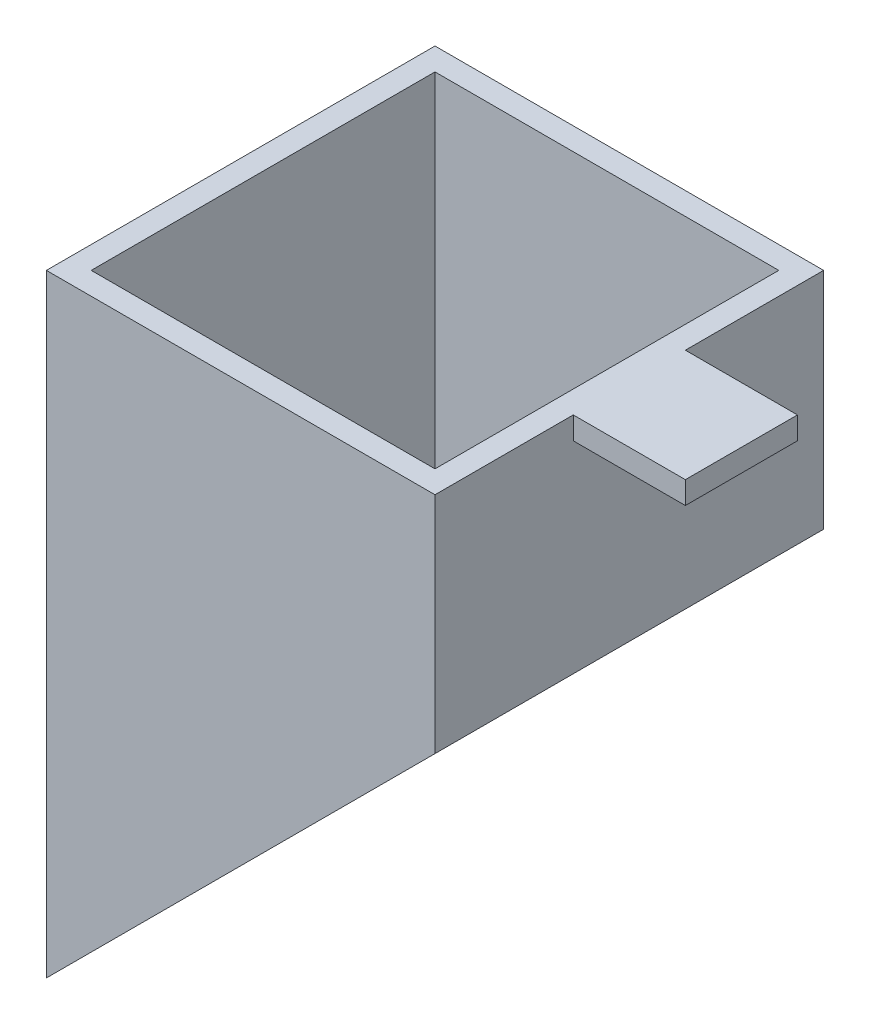
from build123d import *

# Parameters (mm, degrees)
CROQUIS1_W              = 52
CROQUIS1_H              = 52
SALIENTE_EXTRUIR1_DEPTH = 30
SALIENTE_EXTRUIR2_DEPTH = 52
VACIADO4_T              = -3
SALIENTE_EXTRUIR3_DEPTH = 3


with BuildPart() as part:
    # Croquis1 → Saliente-Extruir1 (new body)
    with BuildSketch(Plane(origin=(0, 0, 0), x_dir=(1, 0, 0), z_dir=(0, 1, 0))):
        with Locations((26, 26)):
            Rectangle(CROQUIS1_W, CROQUIS1_H)
    extrude(amount=SALIENTE_EXTRUIR1_DEPTH)

    # Croquis2 → Saliente-Extruir2 (add)
    with BuildSketch(Plane.XY):
        Polygon((0, 0), (0, -52), (52, 0), align=None)
    extrude(amount=-SALIENTE_EXTRUIR2_DEPTH)

    # Vaciado4
    vaciado4_openings = [part.faces().sort_by_distance(p)[0] for p in [
        (26, 30, -26),
        (26, -26, -26),
    ]]
    offset(amount=VACIADO4_T, openings=vaciado4_openings, kind=Kind.INTERSECTION)

    # Croquis3 → Saliente-Extruir3 (add)
    with BuildSketch(Plane(origin=(0, 30, 0), x_dir=(1, 0, 0), z_dir=(0, 1, 0))):
        Polygon((52, 18.5), (67, 18.5), (67, 26), (67, 33.5), (52, 33.5), align=None)
    extrude(amount=-SALIENTE_EXTRUIR3_DEPTH)


solid = part.part
